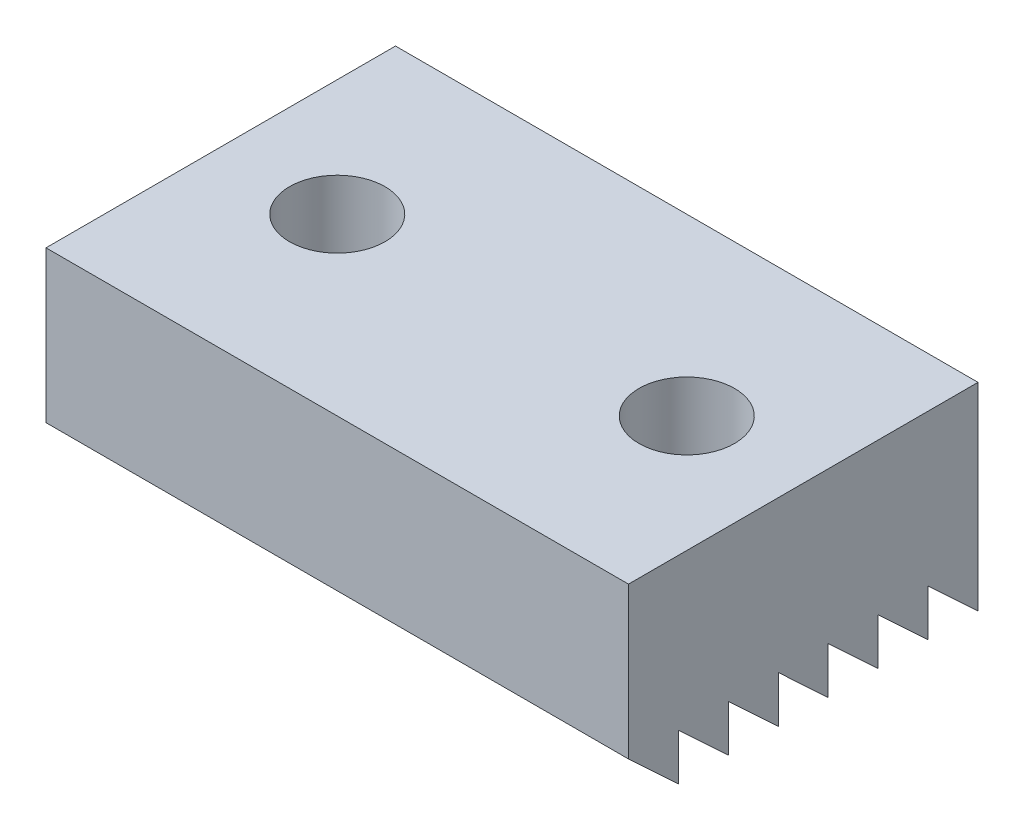
from build123d import *

# Parameters (mm, degrees)
CROQUIS1_W              = 25
CROQUIS1_H              = 15
CROQUIS1_R              = 2.05
SALIENTE_EXTRUIR1_DEPTH = 5
SALIENTE_EXTRUIR2_DEPTH = 25
CORTAR_EXTRUIR1_START   = -29
CROQUIS3_R              = 2.05
CORTAR_EXTRUIR1_DEPTH   = 29


with BuildPart() as part:
    # Croquis1 → Saliente-Extruir1 (new body)
    with BuildSketch(Plane(origin=(0, 0, 0), x_dir=(1, 0, 0), z_dir=(0, 1, 0))):
        with Locations((12.5, 7.5)):
            Rectangle(CROQUIS1_W, CROQUIS1_H)
        with Locations(Location((5, 7.5, 0), (0, 0, 270))):
            Circle(CROQUIS1_R, mode=Mode.SUBTRACT)
        with Locations(Location((20, 7.5, 0), (0, 0, 270))):
            Circle(CROQUIS1_R, mode=Mode.SUBTRACT)
    extrude(amount=SALIENTE_EXTRUIR1_DEPTH)

    # Croquis2 → Saliente-Extruir2 (add)
    with BuildSketch(Plane.ZY):
        Polygon((-15, 0), (-15, -3.5), (-12.857142857, -1.5), (-12.857142857, -3.5), (-10.714285714, -1.5), (-10.714285714, -3.5), (-8.571428571, -1.5), (-8.571428571, -3.5), (-6.428571429, -1.5), (-6.428571429, -3.5), (-4.285714286, -1.5), (-4.285714286, -3.5), (-2.142857143, -1.5), (-2.142857143, -3.5), (0, -1.5), (0, 0), align=None)
    extrude(amount=-SALIENTE_EXTRUIR2_DEPTH)

    # Croquis3 → Cortar-Extruir1 (cut)
    with BuildSketch(Plane(origin=(0, 5, 0), x_dir=(1, 0, 0), z_dir=(0, 1, 0)).offset(CORTAR_EXTRUIR1_START)):
        with Locations(Location((5, 7.5, 0), (0, 0, 148.489952077))):
            Circle(CROQUIS3_R)
        with Locations(Location((20, 7.5, 0), (0, 0, 148.489952077))):
            Circle(CROQUIS3_R)
    extrude(amount=CORTAR_EXTRUIR1_DEPTH, mode=Mode.SUBTRACT)


solid = part.part
